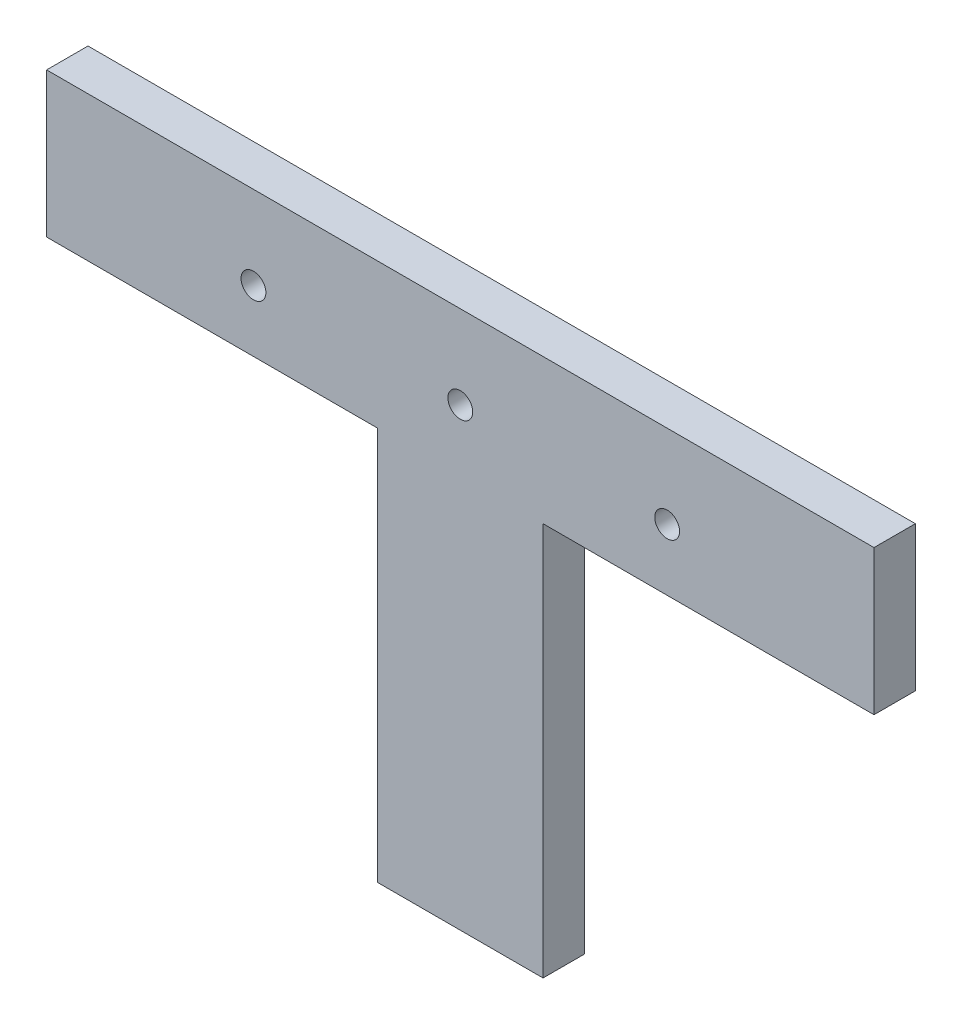
from build123d import *

# Parameters (mm, degrees)
EXTRUDE_1_DEPTH     = 10
SKETCH_2_R          = 3
CUT_EXTRUDE_1_DEPTH = 10
LPATTERN1_COUNT     = 3
LPATTERN1_PITCH     = 50


with BuildPart() as part:
    # 草圖1 → 填料-伸長1 (new body)
    with BuildSketch(Plane.XY):
        Polygon((-40.155141061, 7.219614063), (-80.155141061, 7.219614063), (-80.155141061, 102.329702578), (-160.155141061, 102.329702578), (-160.155141061, 137.329702578), (39.844858939, 137.329702578), (39.844858939, 102.329702578), (-40.155141061, 102.329702578), align=None)
    extrude(amount=EXTRUDE_1_DEPTH)

    # 草圖2 → 除料-伸長1 (cut)
    with BuildSketch(Plane.XY.offset(10)):
        with Locations((-10.155141061, 117.189491535)):
            Circle(SKETCH_2_R)
    cut_extrude_1 = extrude(amount=-CUT_EXTRUDE_1_DEPTH, mode=Mode.SUBTRACT)

    # LPattern1: 除料-伸長1 ×3
    with Locations(*[(-i * LPATTERN1_PITCH, 0, 0) for i in range(1, LPATTERN1_COUNT)]):
        add(cut_extrude_1, mode=Mode.SUBTRACT)


solid = part.part
